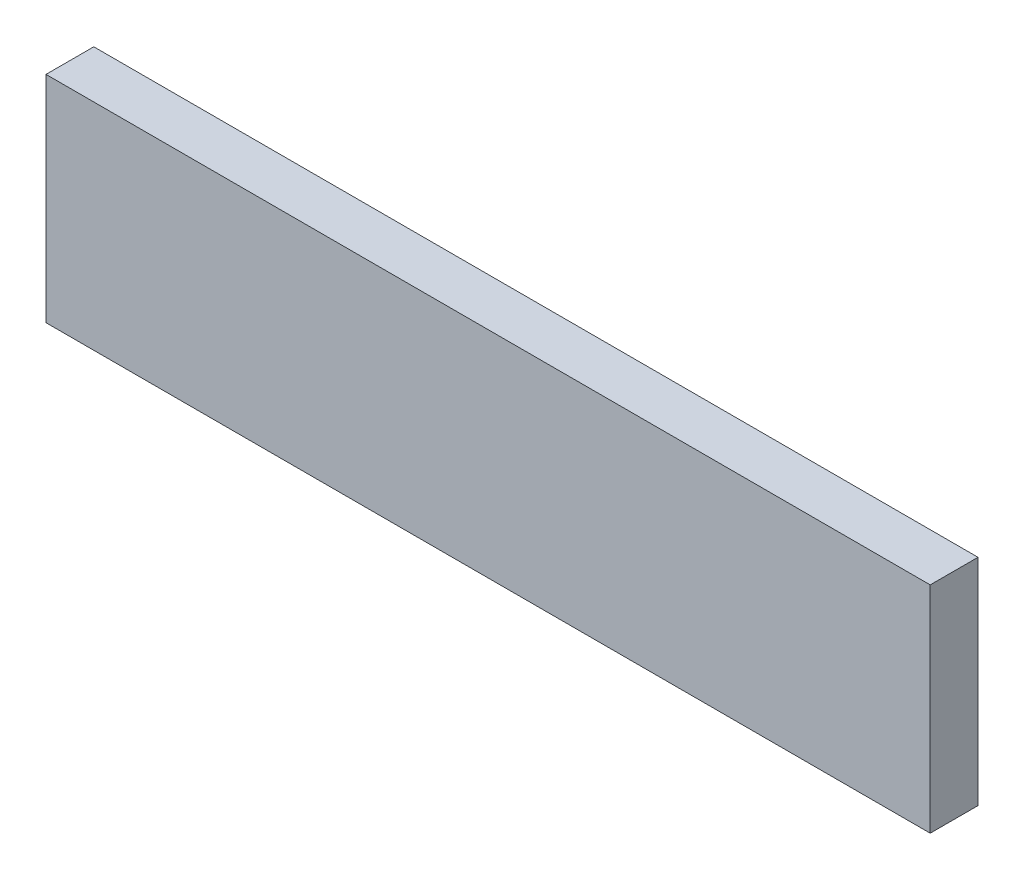
from build123d import *

# Parameters (mm, degrees)
ESBO_O2_W                = 185
ESBO_O2_H                = 45
RESSALTO_EXTRUS_O1_DEPTH = 10


with BuildPart() as part:
    # Esboço2 → Ressalto-extrusão1 (new body)
    with BuildSketch(Plane.XY):
        Rectangle(ESBO_O2_W, ESBO_O2_H)
    extrude(amount=RESSALTO_EXTRUS_O1_DEPTH)


solid = part.part
